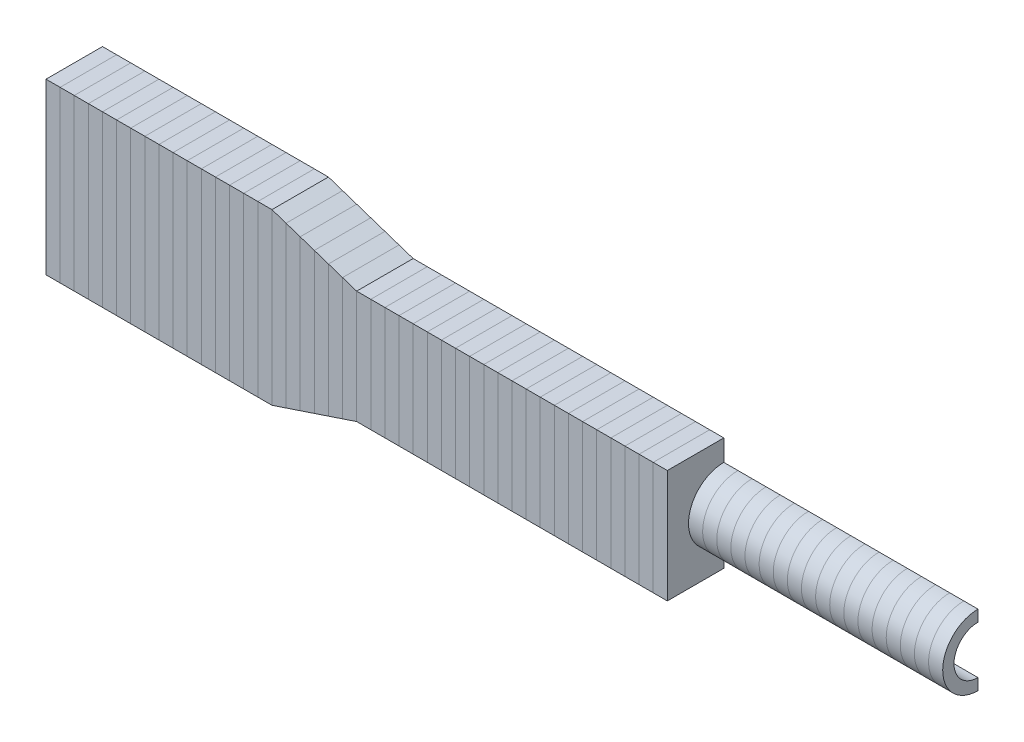
from build123d import *

# Parameters (mm, degrees)
CROQUIS1_W              = 80
CROQUIS1_H              = 60
SALIENTE_EXTRUIR1_DEPTH = 20
SALIENTE_EXTRUIR2_DEPTH = 20
CROQUIS1_4_W            = 100
CROQUIS1_4_H            = 40
SALIENTE_EXTRUIR3_DEPTH = 20
VACIADO1_T              = -2
SALIENTE_EXTRUIR4_DEPTH = 20
CROQUIS1_6_W            = 90
CROQUIS1_6_H            = 4
VACIADO2_T              = -2
VACIADO3_T              = -2
CORTAR_EXTRUIR2_DEPTH   = 72


with BuildPart() as part:
    # Croquis1 → Saliente-Extruir1 (new, symmetric)
    with BuildSketch(Plane.XY):
        with Locations((40, 0)):
            Rectangle(CROQUIS1_W, CROQUIS1_H)
    extrude(amount=SALIENTE_EXTRUIR1_DEPTH, both=True)

    # Vaciado1
    vaciado1_openings = [part.faces().sort_by_distance(p)[0] for p in [
        (80, 0, 0),
        (0, 0, 0),
    ]]
    offset(amount=VACIADO1_T, openings=vaciado1_openings, kind=Kind.INTERSECTION)


with BuildPart() as body_2:
    # Croquis1<3> → Saliente-Extruir2 (new, symmetric)
    with BuildSketch(Plane.XY):
        Polygon((80, 30), (80, -30), (110, -20), (110, 20), align=None)
    extrude(amount=SALIENTE_EXTRUIR2_DEPTH, both=True)

    # Vaciado2
    vaciado2_openings = [body_2.faces().sort_by_distance(p)[0] for p in [
        (110, 0, 0),
        (80, 0, 0),
    ]]
    offset(amount=VACIADO2_T, openings=vaciado2_openings, kind=Kind.INTERSECTION)


with BuildPart() as body_3:
    # Croquis1<4> → Saliente-Extruir3 (new, symmetric)
    with BuildSketch(Plane.XY):
        with Locations((160, 0)):
            Rectangle(CROQUIS1_4_W, CROQUIS1_4_H)
    extrude(amount=SALIENTE_EXTRUIR3_DEPTH, both=True)

    # Vaciado3
    vaciado3_openings = [body_3.faces().sort_by_distance(p)[0] for p in [
        (210, 0, 0),
        (110, 0, 0),
    ]]
    offset(amount=VACIADO3_T, openings=vaciado3_openings, kind=Kind.INTERSECTION)


with BuildPart() as body_4:
    # Croquis1<7> → Saliente-Extruir4 (new, symmetric)
    with BuildSketch(Plane.XY):
        Polygon((210, 20), (210, -20), (220, -20), (220, -12.5), (220, -8.5), (220, 8.5), (220, 12.5), (220, 20), align=None)
    extrude(amount=SALIENTE_EXTRUIR4_DEPTH, both=True)


with BuildPart() as body_5:
    # Croquis1<6> → Revolución1 (revolve)
    with BuildSketch(Plane.XY):
        with Locations((265, 10.5)):
            Rectangle(CROQUIS1_6_W, CROQUIS1_6_H)
    revolve(axis=Axis((210, 0, 0), (-1, 0, 0)))


with BuildPart() as cortar_extruir2_tool:
    # Croquis6 → Cortar-Extruir2 (new, symmetric)
    with BuildSketch(Plane(origin=(0, 0, 0), x_dir=(1, 0, 0), z_dir=(0, 1, 0))):
        Polygon((0, 0), (340.896123577, 0), (340.896123577, 59.379495174), (-32.701047908, 59.379495174), (-32.701047908, 29.689747587), align=None)
    extrude(amount=CORTAR_EXTRUIR2_DEPTH, both=True)


with BuildPart() as part_1:
    add(part.part)

    # Cortar-Extruir2: cut by cortar_extruir2_tool
    add(cortar_extruir2_tool.part, mode=Mode.SUBTRACT)


with BuildPart() as body_2_1:
    add(body_2.part)

    # Cortar-Extruir2: cut by cortar_extruir2_tool
    add(cortar_extruir2_tool.part, mode=Mode.SUBTRACT)


with BuildPart() as body_3_1:
    add(body_3.part)

    # Cortar-Extruir2: cut by cortar_extruir2_tool
    add(cortar_extruir2_tool.part, mode=Mode.SUBTRACT)


with BuildPart() as body_4_1:
    add(body_4.part)

    # Cortar-Extruir2: cut by cortar_extruir2_tool
    add(cortar_extruir2_tool.part, mode=Mode.SUBTRACT)


with BuildPart() as body_5_1:
    add(body_5.part)

    # Cortar-Extruir2: cut by cortar_extruir2_tool
    add(cortar_extruir2_tool.part, mode=Mode.SUBTRACT)


solid = Compound([part_1.part, body_2_1.part, body_3_1.part, body_4_1.part, body_5_1.part])
